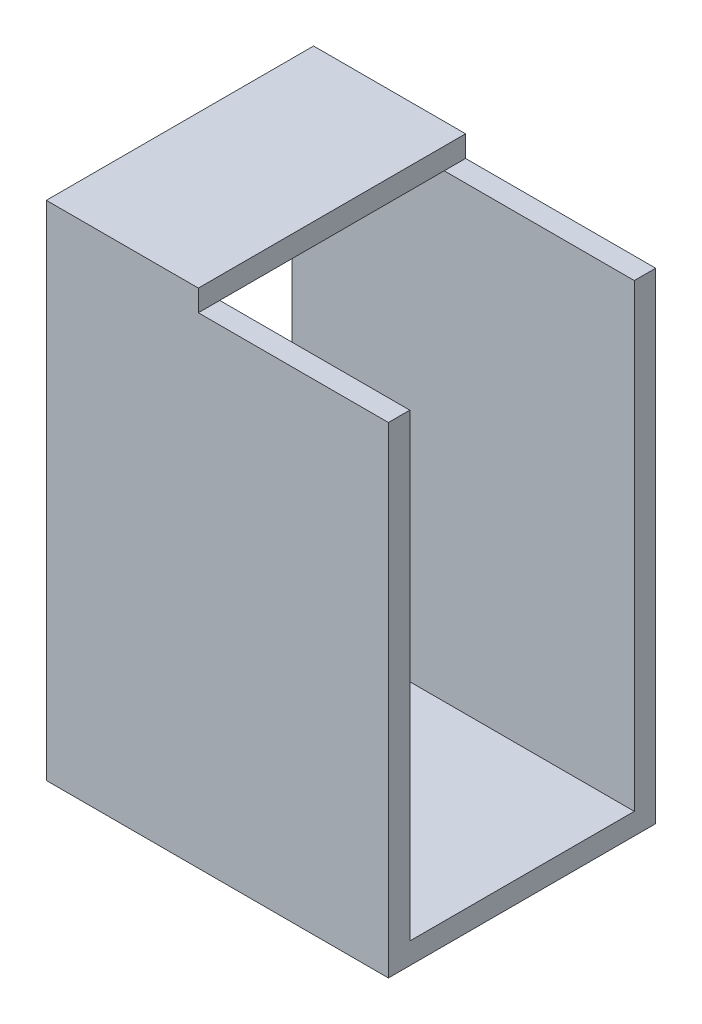
from build123d import *

# Parameters (mm, degrees)
SKETCH1_W           = 160
SKETCH1_H           = 215
BOSS_EXTRUDE1_DEPTH = 105
SHELL2_T            = 10
SKETCH6_W           = 88.9
SKETCH6_H           = 125
CUT_EXTRUDE3_DEPTH  = 10


with BuildPart() as part:
    # Sketch1 → Boss-Extrude1 (new body)
    with BuildSketch(Plane.XY):
        with Locations((80, 107.5)):
            Rectangle(SKETCH1_W, SKETCH1_H)
    extrude(amount=BOSS_EXTRUDE1_DEPTH)

    # Shell2
    shell2_openings = [part.faces().sort_by_distance(p)[0] for p in [
        (160, 107.5, 52.5),
        (0, 107.5, 52.5),
    ]]
    offset(amount=SHELL2_T, openings=shell2_openings, kind=Kind.INTERSECTION)

    # Sketch6 → Cut-Extrude3 (cut)
    with BuildSketch(Plane.XZ.offset(-225)):
        with Locations((115.55, 52.5)):
            Rectangle(SKETCH6_W, SKETCH6_H)
    extrude(amount=CUT_EXTRUDE3_DEPTH, mode=Mode.SUBTRACT)


solid = part.part
